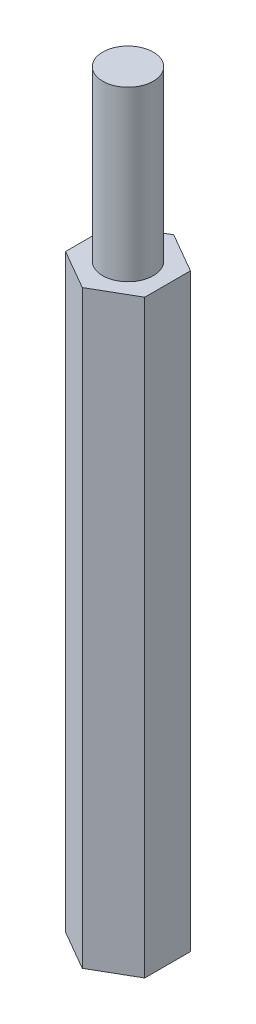
from build123d import *

# Parameters (mm, degrees)
BOSS_EXTRUDE1_DEPTH = 35
SKETCH2_R           = 1.5
BOSS_EXTRUDE2_DEPTH = 10
SKETCH5_R           = 1.5
CUT_EXTRUDE1_DEPTH  = 10


with BuildPart() as part:
    # Sketch1 → Boss-Extrude1 (new body)
    with BuildSketch(Plane(origin=(0, 0, 0), x_dir=(1, 0, 0), z_dir=(0, 1, 0))):
        Polygon((0, 2.713546265), (-2.35, 1.356773133), (-2.35, -1.356773133), (0, -2.713546265), (2.35, -1.356773133), (2.35, 1.356773133), align=None)
    extrude(amount=BOSS_EXTRUDE1_DEPTH)

    # Sketch2 → Boss-Extrude2 (add)
    with BuildSketch(Plane(origin=(0, 35, 0), x_dir=(1, 0, 0), z_dir=(0, 1, 0))):
        with Locations(Location((0, 0, 0), (0, 0, 270))):
            Circle(SKETCH2_R)
    extrude(amount=BOSS_EXTRUDE2_DEPTH)

    # Sketch5 → Cut-Extrude1 (cut)
    with BuildSketch(Plane.XZ):
        with Locations(Location((0, 0, 0), (0, 0, 90))):
            Circle(SKETCH5_R)
    extrude(amount=-CUT_EXTRUDE1_DEPTH, mode=Mode.SUBTRACT)


solid = part.part
